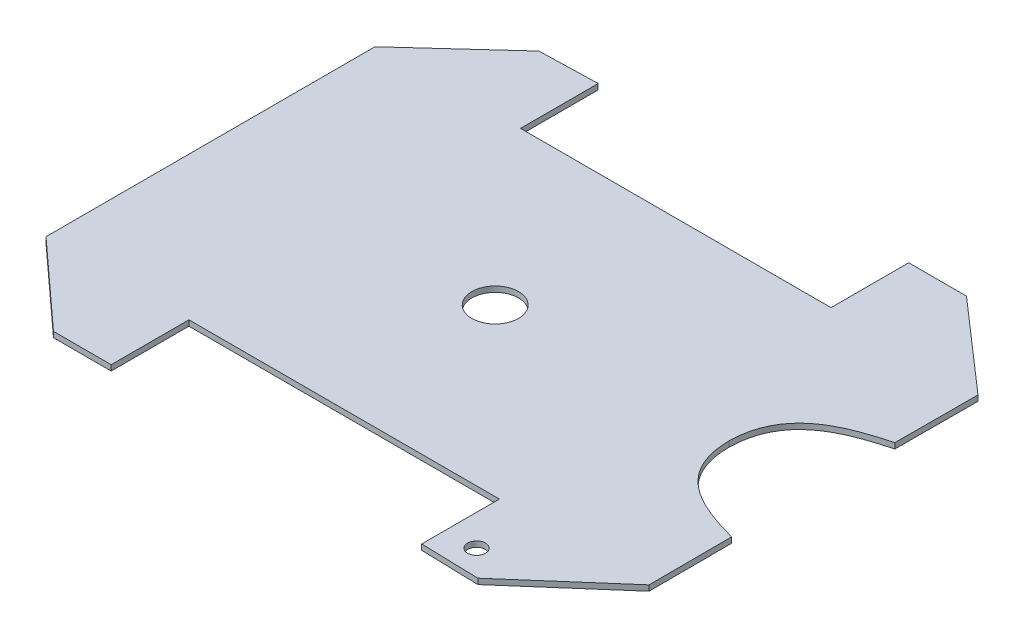
from build123d import *

# Parameters (mm, degrees)
EXTRUDE_1_DEPTH     = 5
SKETCH_2_R          = 21
CUT_EXTRUDE_1_DEPTH = 403.120979525
SKETCH1_R           = 8
CUT_EXTRUDE1_DEPTH  = 403.120979525


with BuildPart() as part:
    # Эскиз1 → Вытянуть1 (new body)
    with BuildSketch(Plane(origin=(0, 0, 0), x_dir=(1, 0, 0), z_dir=(0, 1, 0))):
        with BuildLine():
            Line((-269.7921816, 73.262575573), (-269.7921816, -223.012011978))
            Line((-269.7921816, -223.012011978), (-192.586469874, -293.492830448))
            Line((-192.586469874, -293.492830448), (-140.586469874, -293.492830448))
            Line((-140.586469874, -293.492830448), (-140.586469874, -223.492830448))
            Line((-140.586469874, -223.492830448), (139.068300868, -223.492830448))
            Line((139.068300868, -223.492830448), (139.068300868, -293.492830448))
            Line((139.068300868, -293.492830448), (191.068300868, -294.890935713))
            Line((191.068300868, -294.890935713), (273.341577689, -223.012011978))
            Line((273.341577689, -223.012011978), (273.101729514, -148.382005757))
            add(Edge.make_bspline(
                [(273.101729514, -148.382005757), (239.363891717, -139.145872689), (197.437007815, -125.423723423), (197.047353036, -74.874718203)],
                knots=[0, 0, 0, 0, 1, 1, 1, 1], degree=3))
            add(Edge.make_bspline(
                [(273.101729514, -1.367430648), (239.363891717, -10.603563716), (197.437007815, -24.325712982), (197.047353036, -74.874718203)],
                knots=[0, 0, 0, 0, 1, 1, 1, 1], degree=3))
            Line((273.101729514, -1.367430648), (273.341577689, 73.262575573))
            Line((273.341577689, 73.262575573), (191.068300868, 145.141499308))
            Line((191.068300868, 145.141499308), (139.068300868, 145.141499308))
            Line((139.068300868, 145.141499308), (139.068300868, 75.141499308))
            Line((139.068300868, 75.141499308), (-140.586469874, 75.141499308))
            Line((-140.586469874, 75.141499308), (-140.586469874, 145.141499308))
            Line((-140.586469874, 145.141499308), (-192.586469874, 143.743394043))
            Line((-192.586469874, 143.743394043), (-269.7921816, 73.262575573))
        make_face()
    extrude(amount=EXTRUDE_1_DEPTH)

    # Эскиз2 → Вырез-Вытянуть1 (cut, through all)
    with BuildSketch(Plane(origin=(0, 5, 0), x_dir=(-1, 0, 0), z_dir=(0, 1, 0))):
        with Locations(Location((14.229950912, 74.026657254, 0), (0, 0, 90))):
            Circle(SKETCH_2_R)
    extrude(amount=-CUT_EXTRUDE_1_DEPTH, mode=Mode.SUBTRACT)

    # Sketch1 → Cut-Extrude1 (cut, through all)
    with BuildSketch(Plane(origin=(0, 5, 0), x_dir=(1, 0, 0), z_dir=(0, 1, 0))):
        with Locations(Location((167.052967516, -272.065876514, 0), (0, 0, 270))):
            Circle(SKETCH1_R)
    extrude(amount=-CUT_EXTRUDE1_DEPTH, mode=Mode.SUBTRACT)


solid = part.part
